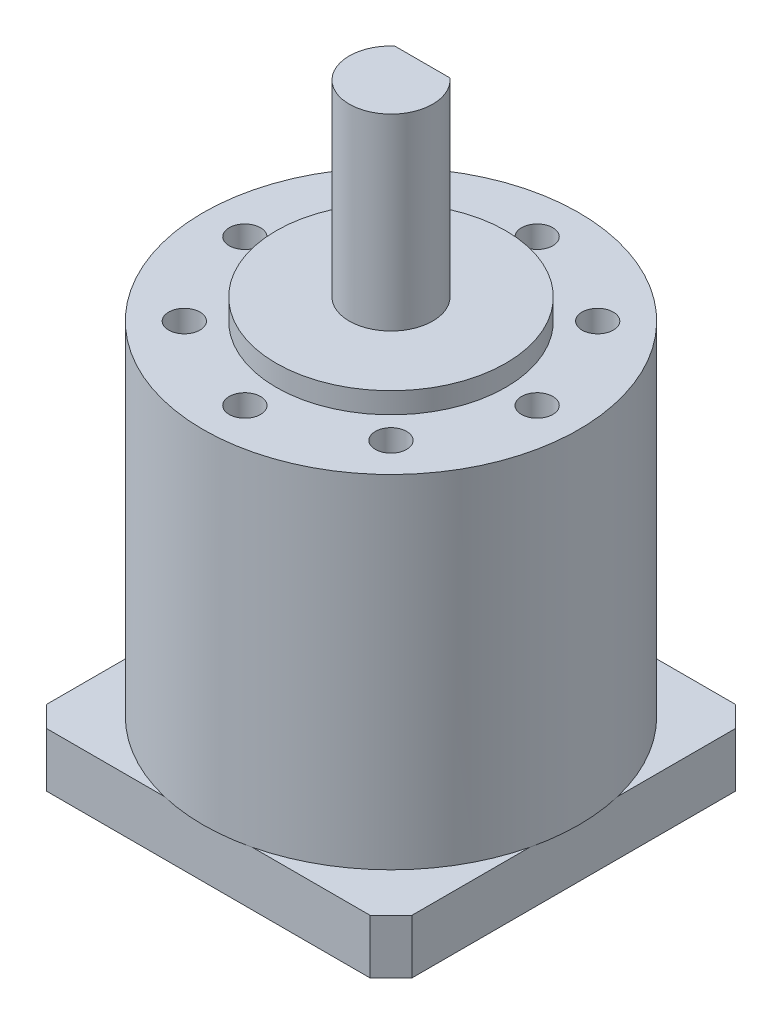
from build123d import *

# Parameters (mm, degrees)
SKETCH_1_W          = 35
SKETCH_1_H          = 35
EXTRUDE_1_DEPTH     = 5.2
SKETCH_2_R          = 18
EXTRUDE_2_DEPTH     = 32.8
SKETCH_3_R          = 11
EXTRUDE_3_DEPTH     = 2
SKETCH_4_R          = 4
EXTRUDE_4_DEPTH     = 18
SKETCH_5_W          = 10.54681648
SKETCH_5_H          = 7.766292135
CUT_EXTRUDE_1_DEPTH = 15
CHAMFER_1_SIZE      = 2
SKETCH_6_R          = 1.5
CUT_EXTRUDE_2_DEPTH = 6
SKETCH_7_R          = 1.5
CUT_EXTRUDE_3_DEPTH = 6


with BuildPart() as part:
    # 草图1 → 凸台-拉伸1 (new body)
    with BuildSketch(Plane(origin=(0, 0, 0), x_dir=(1, 0, 0), z_dir=(0, 1, 0))):
        Rectangle(SKETCH_1_W, SKETCH_1_H)
    extrude(amount=EXTRUDE_1_DEPTH)

    # 草图2 → 凸台-拉伸2 (add)
    with BuildSketch(Plane(origin=(0, 5.2, 0), x_dir=(1, 0, 0), z_dir=(0, 1, 0))):
        with Locations(Location((0, 0, 0), (0, 0, 76.463797263))):
            Circle(SKETCH_2_R)
    extrude(amount=EXTRUDE_2_DEPTH)

    # 草图3 → 凸台-拉伸3 (add)
    with BuildSketch(Plane(origin=(0, 38, 0), x_dir=(1, 0, 0), z_dir=(0, 1, 0))):
        with Locations(Location((0, 0, 0), (0, 0, 270))):
            Circle(SKETCH_3_R)
    extrude(amount=EXTRUDE_3_DEPTH)

    # 草图4 → 凸台-拉伸4 (add)
    with BuildSketch(Plane(origin=(0, 40, 0), x_dir=(1, 0, 0), z_dir=(0, 1, 0))):
        with Locations(Location((0, 0, 0), (0, 0, 270))):
            Circle(SKETCH_4_R)
    extrude(amount=EXTRUDE_4_DEPTH)

    # 草图5 → 切除-拉伸1 (cut)
    with BuildSketch(Plane(origin=(0, 58, 0), x_dir=(1, 0, 0), z_dir=(0, 1, 0))):
        with Locations((0, 6.883146068)):
            Rectangle(SKETCH_5_W, SKETCH_5_H)
    extrude(amount=-CUT_EXTRUDE_1_DEPTH, mode=Mode.SUBTRACT)

    # 倒角1
    chamfer_1_edges = [part.edges().sort_by_distance(p)[0] for p in [
        (17.5, 2.6, 17.5),
        (-17.5, 2.6, 17.5),
        (-17.5, 2.6, -17.5),
        (17.5, 2.6, -17.5),
    ]]
    chamfer(chamfer_1_edges, length=CHAMFER_1_SIZE)

    # 草图6 → 切除-拉伸2 (cut)
    with BuildSketch(Plane(origin=(0, 38, 0), x_dir=(1, 0, 0), z_dir=(0, 1, 0))):
        with Locations(Location((0, 14, 0), (0, 0, 270))):
            Circle(SKETCH_6_R)
        with Locations(Location((14, 0, 0), (0, 0, 270))):
            Circle(SKETCH_6_R)
        with Locations(Location((0, -14, 0), (0, 0, 270))):
            Circle(SKETCH_6_R)
        with Locations(Location((-14, 0, 0), (0, 0, 270))):
            Circle(SKETCH_6_R)
    extrude(amount=-CUT_EXTRUDE_2_DEPTH, mode=Mode.SUBTRACT)

    # 草图7 → 切除-拉伸3 (cut)
    with BuildSketch(Plane(origin=(0, 38, 0), x_dir=(1, 0, 0), z_dir=(0, 1, 0))):
        with Locations(Location((-9.899494937, 9.899494937, 0), (0, 0, 270))):
            Circle(SKETCH_7_R)
        with Locations(Location((9.899494937, 9.899494937, 0), (0, 0, 270))):
            Circle(SKETCH_7_R)
        with Locations(Location((9.899494937, -9.899494937, 0), (0, 0, 270))):
            Circle(SKETCH_7_R)
        with Locations(Location((-9.899494937, -9.899494937, 0), (0, 0, 270))):
            Circle(SKETCH_7_R)
    extrude(amount=-CUT_EXTRUDE_3_DEPTH, mode=Mode.SUBTRACT)


solid = part.part
